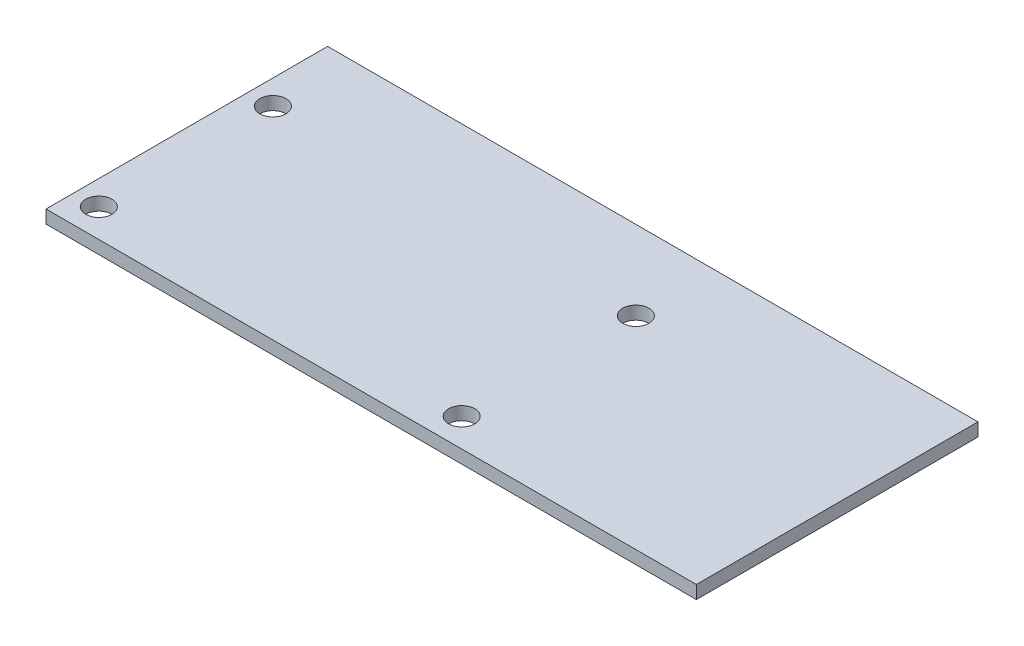
from build123d import *

# Parameters (mm, degrees)
SKETCH1_W           = 78.74
SKETCH1_H           = 34.0995
BOSS_EXTRUDE1_DEPTH = 1.5875
SKETCH2_R           = 1.5875
CUT_EXTRUDE1_DEPTH  = 86.821230803


with BuildPart() as part:
    # Sketch1 → Boss-Extrude1 (new body)
    with BuildSketch(Plane(origin=(0, 0, 0), x_dir=(1, 0, 0), z_dir=(0, 1, 0))):
        with Locations((39.37, 17.04975)):
            Rectangle(SKETCH1_W, SKETCH1_H)
    extrude(amount=BOSS_EXTRUDE1_DEPTH)

    # Sketch2 → Cut-Extrude1 (cut, through all)
    with BuildSketch(Plane(origin=(0, 1.5875, 0), x_dir=(1, 0, 0), z_dir=(0, 1, 0))):
        with Locations(Location((2.9591, 24.511, 0), (0, 0, 270))):
            Circle(SKETCH2_R)
        with Locations(Location((46.9011, 24.511, 0), (0, 0, 270))):
            Circle(SKETCH2_R)
        with Locations(Location((2.9591, 3.429, 0), (0, 0, 270))):
            Circle(SKETCH2_R)
        with Locations(Location((46.9011, 3.429, 0), (0, 0, 270))):
            Circle(SKETCH2_R)
    extrude(amount=-CUT_EXTRUDE1_DEPTH, mode=Mode.SUBTRACT)


solid = part.part
